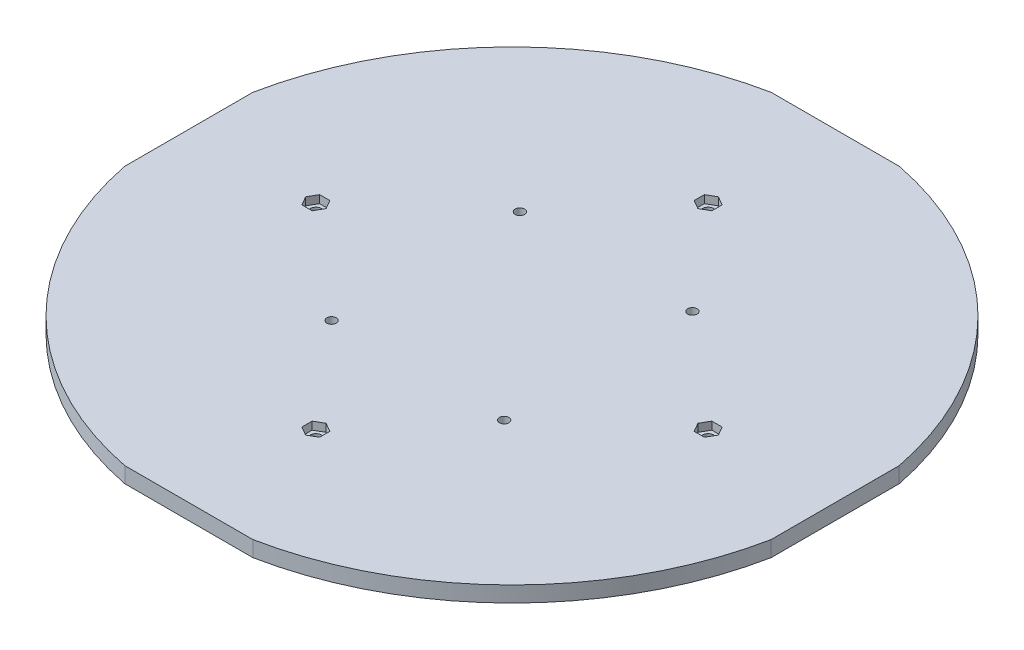
from build123d import *

# Parameters (mm, degrees)
SKETCH1_R           = 105
SKETCH1_R_2         = 1.5
BOSS_EXTRUDE1_DEPTH = 5
CUT_EXTRUDE1_DEPTH  = 2.5
SKETCH2_3_R         = 1.8
CUT_EXTRUDE3_DEPTH  = 149.576579581
CUT_EXTRUDE4_DEPTH  = 149.576579581


with BuildPart() as part:
    # Sketch1 → Boss-Extrude1 (new body)
    with BuildSketch(Plane(origin=(0, 0, 0), x_dir=(1, 0, 0), z_dir=(0, 1, 0))):
        Circle(SKETCH1_R)
        with Locations((-27.5, 30)):
            Circle(SKETCH1_R_2, mode=Mode.SUBTRACT)
        with Locations((27.5, 30)):
            Circle(SKETCH1_R_2, mode=Mode.SUBTRACT)
        with Locations((27.5, -30)):
            Circle(SKETCH1_R_2, mode=Mode.SUBTRACT)
        with Locations((-27.5, -30)):
            Circle(SKETCH1_R_2, mode=Mode.SUBTRACT)
    extrude(amount=BOSS_EXTRUDE1_DEPTH)

    # Sketch2 → Cut-Extrude1 (cut)
    with BuildSketch(Plane(origin=(0, 5, 0), x_dir=(1, 0, 0), z_dir=(0, 1, 0))):
        Polygon((-2.825, 64.13101451), (-2.825, 60.86898549), (0, 59.237970979), (2.825, 60.86898549), (2.825, 64.13101451), (0, 65.762029021), align=None)
        Polygon((-64.13101451, -2.825), (-60.86898549, -2.825), (-59.237970979, 0), (-60.86898549, 2.825), (-64.13101451, 2.825), (-65.762029021, 0), align=None)
        Polygon((64.13101451, 2.825), (60.86898549, 2.825), (59.237970979, 0), (60.86898549, -2.825), (64.13101451, -2.825), (65.762029021, 0), align=None)
        Polygon((2.825, -64.13101451), (2.825, -60.86898549), (0, -59.237970979), (-2.825, -60.86898549), (-2.825, -64.13101451), (0, -65.762029021), align=None)
    extrude(amount=-CUT_EXTRUDE1_DEPTH, mode=Mode.SUBTRACT)

    # Sketch2<3> → Cut-Extrude3 (cut, through all)
    with BuildSketch(Plane(origin=(0, 5, 0), x_dir=(1, 0, 0), z_dir=(0, 1, 0))):
        with Locations((-62.5, 0)):
            Circle(SKETCH2_3_R)
        with Locations((0, 62.5)):
            Circle(SKETCH2_3_R)
        with Locations((62.5, 0)):
            Circle(SKETCH2_3_R)
        with Locations((0, -62.5)):
            Circle(SKETCH2_3_R)
    extrude(amount=-CUT_EXTRUDE3_DEPTH, mode=Mode.SUBTRACT)

    # Sketch4 → Cut-Extrude4 (cut, through all)
    with BuildSketch(Plane(origin=(0, 5, 0), x_dir=(1, 0, 0), z_dir=(0, 1, 0))):
        with BuildLine():
            ThreePointArc((20.396078054, 103), (0, 105), (-20.396078054, 103))
            Line((-20.396078054, 103), (20.396078054, 103))
        make_face()
        with BuildLine():
            Line((-103, -20.396078054), (-103, 20.396078054))
            ThreePointArc((-103, 20.396078054), (-105, 0), (-103, -20.396078054))
        make_face()
        with BuildLine():
            ThreePointArc((103, -20.396078054), (105, 0), (103, 20.396078054))
            Line((103, 20.396078054), (103, -20.396078054))
        make_face()
        with BuildLine():
            Line((20.396078054, -103), (-20.396078054, -103))
            ThreePointArc((-20.396078054, -103), (0, -105), (20.396078054, -103))
        make_face()
    extrude(amount=-CUT_EXTRUDE4_DEPTH, mode=Mode.SUBTRACT)


solid = part.part
